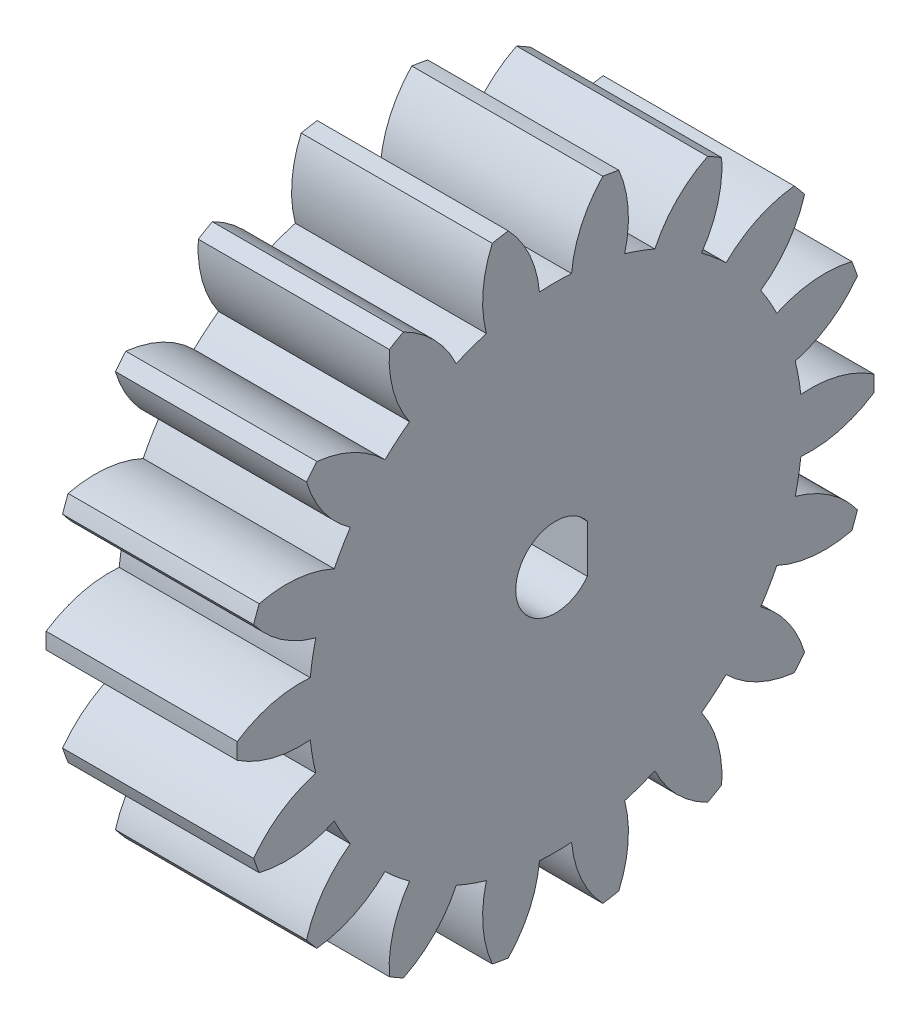
from build123d import *

# Parameters (mm, degrees)
BASPROSKE_W              = 12
BASPROSKE_H              = 20
TOOTHCUT_DEPTH           = 31.724582991
TEETHCUTS_COUNT          = 18
TEETHCUTS_ANGLE          = 340
BORSKE_R                 = 0.1
BORE_DEPTH               = 50.0000508
TAGLIO_ESTRUSIONE1_DEPTH = 13


with BuildPart() as part:
    # BasProSke → Base-Revolve (revolve)
    with BuildSketch(Plane(origin=(0, 0, 0), x_dir=(1, 0, 0), z_dir=(0, 1, 0)), mode=Mode.PRIVATE) as base_revolve_sk:
        with Locations((6, 10)):
            Rectangle(BASPROSKE_W, BASPROSKE_H)
    revolve(base_revolve_sk.sketch.rotate(Axis((-10, 0, 0), (1, 0, 0)), 180), axis=Axis((-10, 0, 0), (1, 0, 0)))

    # TooCutSke → ToothCut (cut, through all)
    with BuildSketch(Plane(origin=(0, 0, 0), x_dir=(0, 0, -1), z_dir=(1, 0, 0))):
        with BuildLine():
            ThreePointArc((1.007799284, 15.466199973), (0, 15.499), (-1.007799284, 15.466199973))
            ThreePointArc((-1.007799284, 15.466199973), (-1.630454606, 17.802374148), (-2.991345877, 19.800719558))
            ThreePointArc((-2.991345877, 19.800719558), (0, 20.0254), (2.991345877, 19.800719558))
            ThreePointArc((2.991345877, 19.800719558), (1.630454606, 17.802374148), (1.007799284, 15.466199973))
        make_face()
    toothcut = extrude(amount=TOOTHCUT_DEPTH, mode=Mode.SUBTRACT)

    # TeethCuts: ToothCut ×18 about axis
    teethcuts_axis = Axis((-10, 0, 0), (1, 0, 0))
    for i in range(1, TEETHCUTS_COUNT):
        add(toothcut.rotate(teethcuts_axis, i * TEETHCUTS_ANGLE / (TEETHCUTS_COUNT - 1)), mode=Mode.SUBTRACT)

    # BorSke → Bore (cut, symmetric)
    with BuildSketch(Plane(origin=(0, 0, 0), x_dir=(0, 0, -1), z_dir=(1, 0, 0))):
        with Locations(Location((0, 0, 0), (0, 0, 180))):
            Circle(BORSKE_R)
    extrude(amount=BORE_DEPTH, both=True, mode=Mode.SUBTRACT)

    # Schizzo1 → Taglio-Estrusione1 (cut)
    with BuildSketch(Plane.ZY):
        with BuildLine():
            Line((-2, 1.5), (-2, -1.5))
            ThreePointArc((-2, -1.5), (2.5, 0), (-2, 1.5))
        make_face()
    extrude(amount=-TAGLIO_ESTRUSIONE1_DEPTH, mode=Mode.SUBTRACT)


solid = part.part
